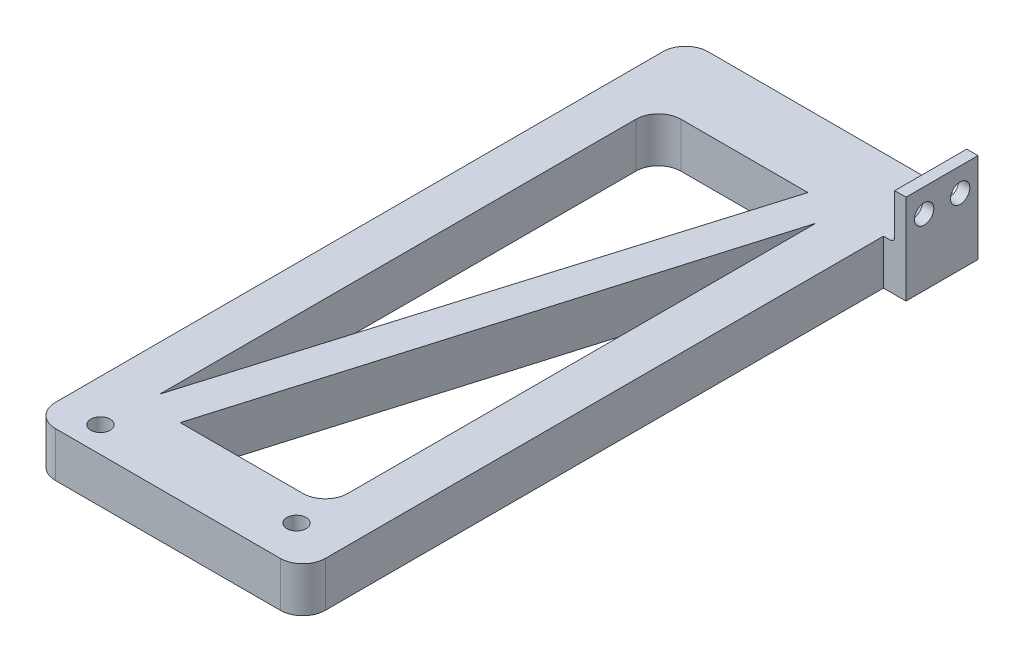
from build123d import *

# Parameters (mm, degrees)
EXTRUDE_1_DEPTH     = 10
SKETCH_4_W          = 2.5
SKETCH_4_H          = 16
EXTRUDE_2_DEPTH     = 10
CUT_EXTRUDE_1_REACH = 103.606
SKETCH_5_R          = 2.15
CUT_EXTRUDE_2_REACH = 93.602
SKETCH_6_R          = 2.15
FILLET_1_R          = 5
FILLET_2_R          = 5
FILLET_3_R          = 1


with BuildPart() as part:
    # 草图1 → 凸台-拉伸1 (new body)
    with BuildSketch(Plane(origin=(0, 0, 0), x_dir=(1, 0, 0), z_dir=(0, 1, 0))):
        Polygon((0.431150433, 77.572237736), (47.680774799, 77.572237736), (47.680774799, 61.572237736), (42.680774799, 61.572237736), (42.680774799, 31.757290204), (42.680774799, -57.600660719), (42.680774799, -67.427762264), (0.431150433, -67.427762264), (-17.319225201, -67.427762264), (-17.319225201, 77.572237736), align=None)
        Polygon((25.906315323, 61.572237736), (-7.319225201, 61.572237736), (-7.319225201, -49.220735683), align=None, mode=Mode.SUBTRACT)
        Polygon((0.431150433, -52.427762264), (32.680774799, -52.427762264), (32.680774799, 56.508121895), align=None, mode=Mode.SUBTRACT)
    extrude(amount=EXTRUDE_1_DEPTH)

    # 草图4 → 凸台-拉伸2 (add)
    with BuildSketch(Plane(origin=(0, 10, 0), x_dir=(1, 0, 0), z_dir=(0, 1, 0))):
        with Locations((46.430774799, 69.572237736)):
            Rectangle(SKETCH_4_W, SKETCH_4_H)
    extrude(amount=EXTRUDE_2_DEPTH)

    # 草图5 → 切除-拉伸1 (cut, up to next)
    with BuildSketch(Plane.ZY.offset(-45.180774799), mode=Mode.PRIVATE) as cut_extrude_1_sk1:
        with Locations((-73.607625165, 14.752522231)):
            Circle(SKETCH_5_R)
    cut_extrude_1_tool1 = extrude(cut_extrude_1_sk1.sketch, amount=-CUT_EXTRUDE_1_REACH, mode=Mode.PRIVATE) & part.part
    # 草图5 → 切除-拉伸1 (cut, up to next)
    with BuildSketch(Plane.ZY.offset(-45.180774799), mode=Mode.PRIVATE) as cut_extrude_1_sk2:
        with Locations((-65.607625165, 14.752522231)):
            Circle(SKETCH_5_R)
    cut_extrude_1_tool2 = extrude(cut_extrude_1_sk2.sketch, amount=-CUT_EXTRUDE_1_REACH, mode=Mode.PRIVATE) & part.part
    add(cut_extrude_1_tool1.solids().sort_by_distance((45.180775, 14.752522, -73.607625))[0], mode=Mode.SUBTRACT)
    add(cut_extrude_1_tool2.solids().sort_by_distance((45.180775, 14.752522, -65.607625))[0], mode=Mode.SUBTRACT)

    # 草图6 → 切除-拉伸2 (cut, up to next)
    with BuildSketch(Plane(origin=(0, 10, 0), x_dir=(1, 0, 0), z_dir=(0, 1, 0)), mode=Mode.PRIVATE) as cut_extrude_2_sk1:
        with Locations(Location((-8.019225201, -61.690086649, 0), (0, 0, 270))):
            Circle(SKETCH_6_R)
    cut_extrude_2_tool1 = extrude(cut_extrude_2_sk1.sketch, amount=-CUT_EXTRUDE_2_REACH, mode=Mode.PRIVATE) & part.part
    # 草图6 → 切除-拉伸2 (cut, up to next)
    with BuildSketch(Plane(origin=(0, 10, 0), x_dir=(1, 0, 0), z_dir=(0, 1, 0)), mode=Mode.PRIVATE) as cut_extrude_2_sk2:
        with Locations(Location((32.680774799, -58.840086649, 0), (0, 0, 270))):
            Circle(SKETCH_6_R)
    cut_extrude_2_tool2 = extrude(cut_extrude_2_sk2.sketch, amount=-CUT_EXTRUDE_2_REACH, mode=Mode.PRIVATE) & part.part
    add(cut_extrude_2_tool1.solids().sort_by_distance((-8.019225, 10, 61.690087))[0], mode=Mode.SUBTRACT)
    add(cut_extrude_2_tool2.solids().sort_by_distance((32.680775, 10, 58.840087))[0], mode=Mode.SUBTRACT)

    # 圆角1
    fillet_1_edges = [part.edges().sort_by_distance(p)[0] for p in [
        (-17.319225201, 5, 67.427762264),
        (-17.319225201, 5, -77.572237736),
        (42.680774799, 5, 67.427762264),
    ]]
    fillet(fillet_1_edges, radius=FILLET_1_R)

    # 圆角2
    fillet_2_edges = [part.edges().sort_by_distance(p)[0] for p in [
        (-7.319225201, 5, -61.572237736),
        (32.680774799, 5, 52.427762264),
    ]]
    fillet(fillet_2_edges, radius=FILLET_2_R)

    # 圆角3
    fillet_3_edges = [part.edges().sort_by_distance(p)[0] for p in [
        (45.180774799, 10, -69.572237736),
    ]]
    fillet(fillet_3_edges, radius=FILLET_3_R)


solid = part.part
